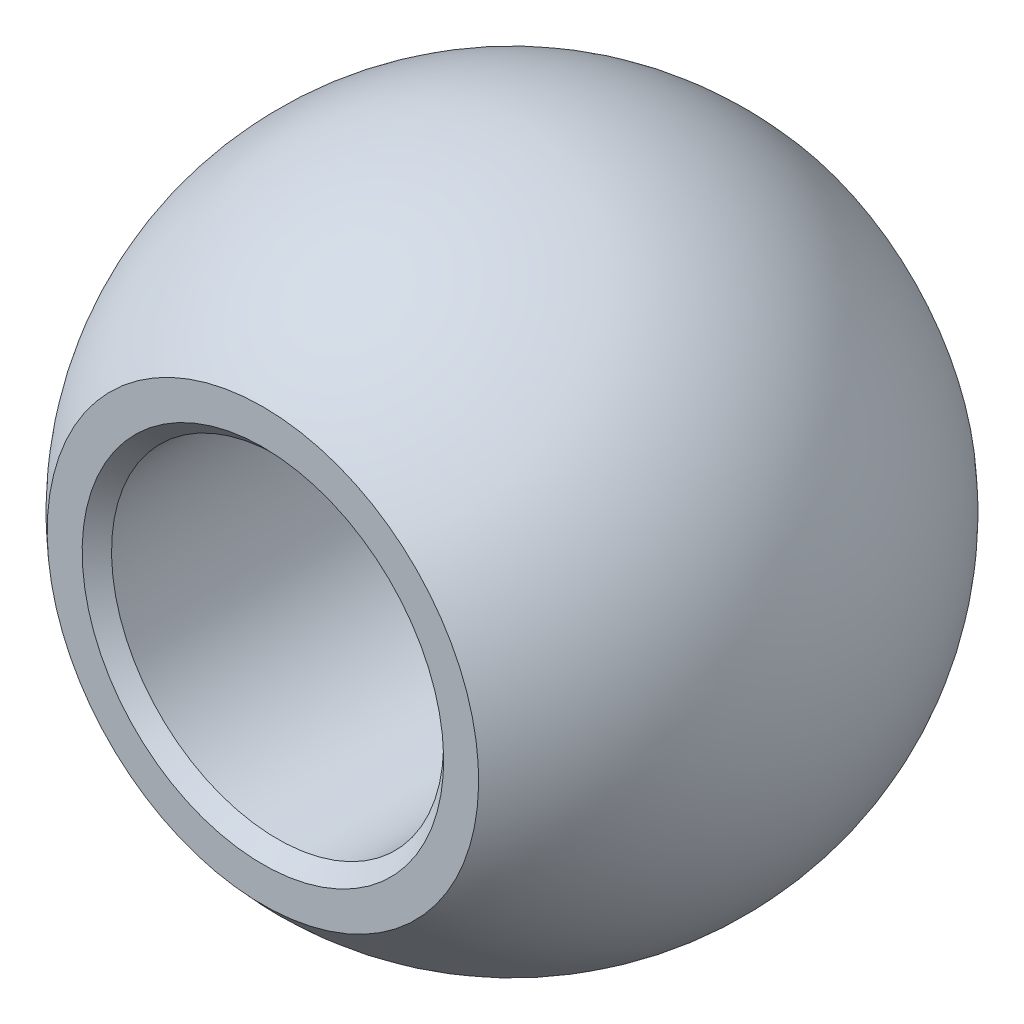
from build123d import *

# Parameters (mm, degrees)
BODY_MOVE_COPY1_ANGLE = 90


with BuildPart() as part:
    # Sketch6 → Ball (revolve)
    with BuildSketch(Plane.XY):
        with BuildLine():
            Line((5.646353764, 4), (-5.646353764, 4))
            Line((-5.646353764, 4), (-6, 4.353646236))
            Line((-6, 4.353646236), (-6, 5.196528288))
            ThreePointArc((-6, 5.196528288), (0, 7.9375), (6, 5.196528288))
            Line((6, 5.196528288), (6, 4.353646236))
            Line((6, 4.353646236), (5.646353764, 4))
        make_face()
    revolve(axis=Axis((0, 0, 0), (-1, 0, 0)))


with BuildPart() as part_1:
    # Body-Move/Copy1: moved
    add(part.part.rotate(Axis((0, 0, 0), (0, 1, 0)), BODY_MOVE_COPY1_ANGLE))


solid = part_1.part
